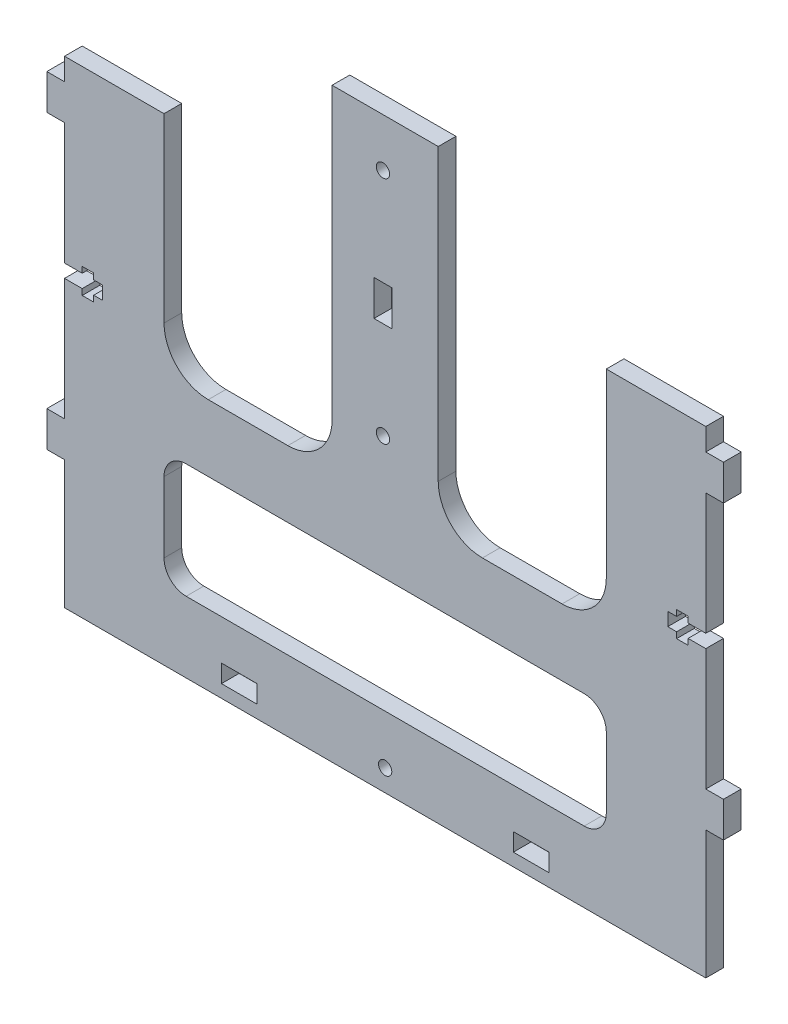
from build123d import *

# Parameters (mm, degrees)
SKETCH_1_W      = 8.03
SKETCH_1_H      = 4.03
SKETCH_1_R      = 1.5
SKETCH_1_W_2    = 4.04
SKETCH_1_H_2    = 8.04
EXTRUDE_1_DEPTH = 4


with BuildPart() as part:
    # 草图1 → 凸台-拉伸1 (new body)
    with BuildSketch(Plane.XY):
        with BuildLine():
            Line((149, 64.5), (145, 64.5))
            Line((145, 64.5), (145, 37))
            Line((145, 37), (141, 37))
            Line((141, 37), (141, 29))
            Line((141, 29), (145, 29))
            Line((145, 29), (145, 0))
            Line((145, 0), (290, 0))
            Line((290, 0), (290, 29))
            Line((290, 29), (294, 29))
            Line((294, 29), (294, 37))
            Line((294, 37), (290, 37))
            Line((290, 37), (290, 64.5))
            Line((290, 64.5), (286, 64.5))
            Line((286, 64.5), (286, 63.15))
            Line((286, 63.15), (283.4, 63.15))
            Line((283.4, 63.15), (283.4, 64.5))
            Line((283.4, 64.5), (281.4, 64.5))
            Line((281.4, 64.5), (281.4, 67.5))
            Line((281.4, 67.5), (283.4, 67.5))
            Line((283.4, 67.5), (283.4, 68.85))
            Line((283.4, 68.85), (286, 68.85))
            Line((286, 68.85), (286, 67.5))
            Line((286, 67.5), (290, 67.5))
            Line((290, 67.5), (290, 95))
            Line((290, 95), (294, 95))
            Line((294, 95), (294, 103))
            Line((294, 103), (290, 103))
            Line((290, 103), (290, 108))
            Line((290, 108), (267.5, 108))
            Line((267.5, 108), (267.5, 67))
            ThreePointArc((267.5, 67), (264.571067812, 59.928932188), (257.5, 57))
            Line((257.5, 57), (239.5, 57))
            ThreePointArc((239.5, 57), (232.428932188, 59.928932188), (229.5, 67))
            Line((229.5, 67), (229.5, 132.57))
            Line((229.5, 132.57), (205.5, 132.57))
            Line((205.5, 132.57), (205.5, 67))
            ThreePointArc((205.5, 67), (202.571067812, 59.928932188), (195.5, 57))
            Line((195.5, 57), (177.5, 57))
            ThreePointArc((177.5, 57), (170.428932188, 59.928932188), (167.5, 67))
            Line((167.5, 67), (167.5, 108))
            Line((167.5, 108), (145, 108))
            Line((145, 108), (145, 103))
            Line((145, 103), (141, 103))
            Line((141, 103), (141, 95))
            Line((141, 95), (145, 95))
            Line((145, 95), (145, 67.5))
            Line((145, 67.5), (149, 67.5))
            Line((149, 67.5), (149, 68.85))
            Line((149, 68.85), (151.6, 68.85))
            Line((151.6, 68.85), (151.6, 67.5))
            Line((151.6, 67.5), (153.6, 67.5))
            Line((153.6, 67.5), (153.6, 64.5))
            Line((153.6, 64.5), (151.6, 64.5))
            Line((151.6, 64.5), (151.6, 63.15))
            Line((151.6, 63.15), (149, 63.15))
            Line((149, 63.15), (149, 64.5))
        make_face()
        with Locations((184.5, 4.9)):
            Rectangle(SKETCH_1_W, SKETCH_1_H, mode=Mode.SUBTRACT)
        with BuildLine():
            ThreePointArc((167.5, 36.934316811), (168.964466094, 40.469850717), (172.5, 41.934316811))
            Line((172.5, 41.934316811), (262.5, 41.934316811))
            ThreePointArc((262.5, 41.934316811), (266.035533906, 40.469850717), (267.5, 36.934316811))
            Line((267.5, 36.934316811), (267.5, 21))
            ThreePointArc((267.5, 21), (266.035533906, 17.464466094), (262.5, 16))
            Line((262.5, 16), (172.5, 16))
            ThreePointArc((172.5, 16), (168.964466094, 17.464466094), (167.5, 21))
            Line((167.5, 21), (167.5, 36.934316811))
        make_face(mode=Mode.SUBTRACT)
        with Locations((217.5, 4.9)):
            Circle(SKETCH_1_R, mode=Mode.SUBTRACT)
        with Locations((250.5, 4.9)):
            Rectangle(SKETCH_1_W, SKETCH_1_H, mode=Mode.SUBTRACT)
        with Locations((217, 69.654316811)):
            Circle(SKETCH_1_R, mode=Mode.SUBTRACT)
        with Locations((217, 95.654316811)):
            Rectangle(SKETCH_1_W_2, SKETCH_1_H_2, mode=Mode.SUBTRACT)
        with Locations((217, 121.654316811)):
            Circle(SKETCH_1_R, mode=Mode.SUBTRACT)
    extrude(amount=EXTRUDE_1_DEPTH)


solid = part.part
